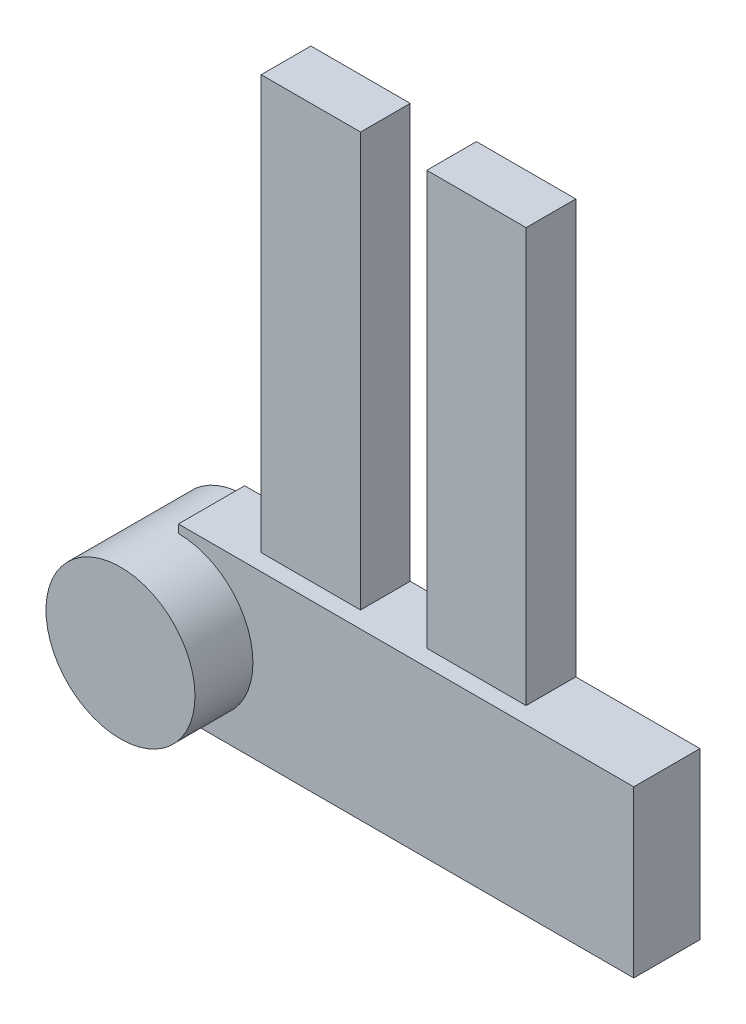
from build123d import *

# Parameters (mm, degrees)
SKETCH_1_W      = 55000
SKETCH_1_H      = 20000
EXTRUDE_1_DEPTH = 8000
SKETCH_2_R      = 9000
EXTRUDE_2_DEPTH = 15000
SKETCH_3_W      = 12000
SKETCH_3_H      = 52000
EXTRUDE_3_DEPTH = 6000
SKETCH_4_W      = 12000
SKETCH_4_H      = 52000
EXTRUDE_4_DEPTH = 6000


with BuildPart() as part:
    # 草图1 → 凸台-拉伸1 (new body)
    with BuildSketch(Plane.XY):
        with Locations((257500, 115000)):
            Rectangle(SKETCH_1_W, SKETCH_1_H)
    extrude(amount=EXTRUDE_1_DEPTH)

    # 草图2 → 凸台-拉伸2 (add)
    with BuildSketch(Plane.XY):
        with Locations(Location((230000, 115000, 0), (0, 0, 270))):
            Circle(SKETCH_2_R)
    extrude(amount=EXTRUDE_2_DEPTH)

    # 草图3 → 凸台-拉伸3 (add)
    with BuildSketch(Plane.XY):
        with Locations((244000, 149000)):
            Rectangle(SKETCH_3_W, SKETCH_3_H)
    extrude(amount=EXTRUDE_3_DEPTH)

    # 草图4 → 凸台-拉伸4 (add)
    with BuildSketch(Plane.XY):
        with Locations((264000, 149000)):
            Rectangle(SKETCH_4_W, SKETCH_4_H)
    extrude(amount=EXTRUDE_4_DEPTH)


solid = part.part
